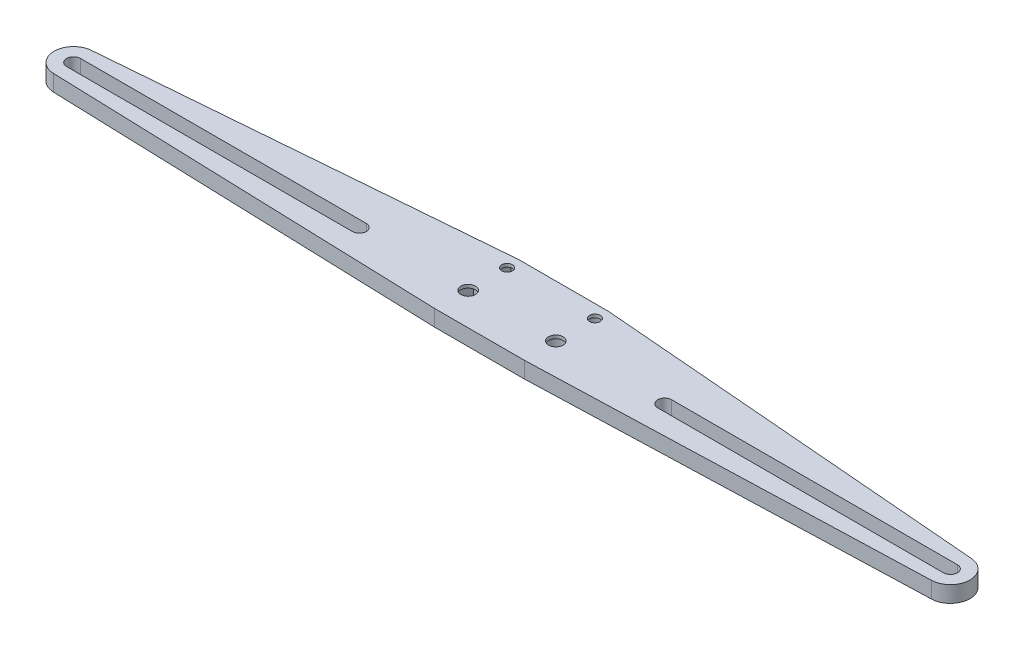
from build123d import *

# Parameters (mm, degrees)
SKETCH1_R           = 2.25
SKETCH1_R_2         = 1.65
BOSS_EXTRUDE1_DEPTH = 5
SKETCH3_R           = 3.75
SKETCH3_R_2         = 3
CUT_EXTRUDE1_DEPTH  = 4


with BuildPart() as part:
    # Sketch1 → Boss-Extrude1 (new body)
    with BuildSketch(Plane(origin=(0, 0, 0), x_dir=(1, 0, 0), z_dir=(0, 1, 0))):
        with BuildLine():
            Line((0, 15.986538484), (0, -10))
            Line((0, -10), (13.827888575, -10))
            Line((13.827888575, -10), (135.197796243, -5.996738834))
            ThreePointArc((135.197796243, -5.996738834), (140.998192557, -0.147261838), (135.491832862, 5.979807726))
            Line((135.491832862, 5.979807726), (13.827888575, 15.986538484))
            Line((13.827888575, 15.986538484), (0, 15.986538484))
        make_face()
        with Locations(Location((13.5, 0, 0), (0, 0, 270))):
            Circle(SKETCH1_R, mode=Mode.SUBTRACT)
        with BuildLine():
            ThreePointArc((47, -2.15), (44.85, 0), (47, 2.15))
            Line((47, 2.15), (135, 2.15))
            ThreePointArc((135, 2.15), (137.15, 0), (135, -2.15))
            Line((135, -2.15), (47, -2.15))
        make_face(mode=Mode.SUBTRACT)
        with Locations(Location((13.5, 12, 0), (0, 0, 270))):
            Circle(SKETCH1_R_2, mode=Mode.SUBTRACT)
    extrude(amount=BOSS_EXTRUDE1_DEPTH)

    # Mirror1: part across plane


with BuildPart() as part_1:
    add(part.part)
    add(part.part.mirror(Plane(origin=(0, 0, 0), x_dir=(0, 0, 1), z_dir=(1, 0, 0))))

    # Sketch3 → Cut-Extrude1 (cut)
    with BuildSketch(Plane(origin=(0, 0, 0), x_dir=(1, 0, 0), z_dir=(0, 1, 0))):
        with Locations(Location((13.5, 0, 0), (0, 0, 270))):
            Circle(SKETCH3_R)
        with Locations(Location((13.5, 12, 0), (0, 0, 270))):
            Circle(SKETCH3_R_2)
        Polygon((-9.169872981, 0), (-11.334936491, 3.75), (-15.665063509, 3.75), (-17.830127019, 0), (-15.665063509, -3.75), (-11.334936491, -3.75), align=None)
        Polygon((-10.035898385, 12), (-11.767949192, 15), (-15.232050808, 15), (-16.964101615, 12), (-15.232050808, 9), (-11.767949192, 9), align=None)
    extrude(amount=CUT_EXTRUDE1_DEPTH, mode=Mode.SUBTRACT)


solid = part_1.part
